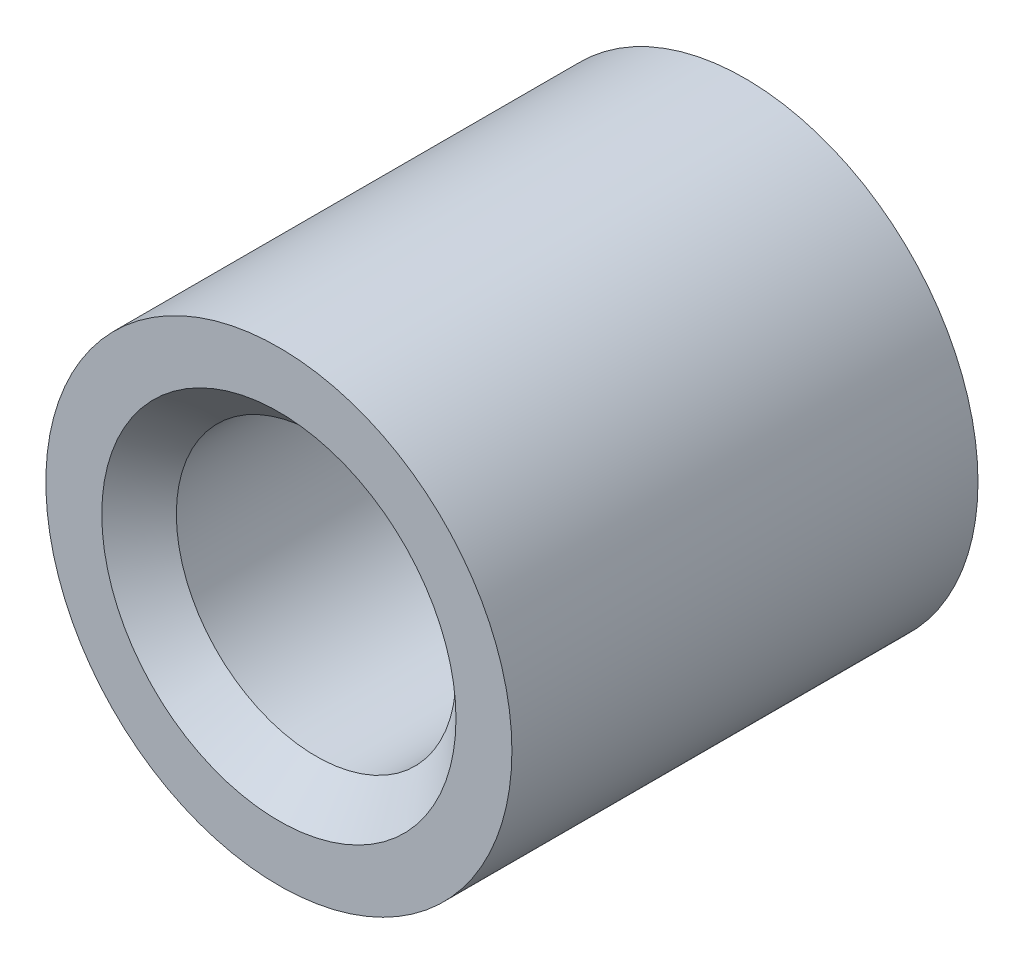
from build123d import *

# Parameters (mm, degrees)
SKETCH2_R           = 7.9375
SKETCH2_R_2         = 4.7625
BOSS_EXTRUDE1_DEPTH = 15.875
CHAMFER1_SIZE       = 1.27


with BuildPart() as part:
    # Sketch2 → Boss-Extrude1 (new body)
    with BuildSketch(Plane.XY):
        Circle(SKETCH2_R)
        Circle(SKETCH2_R_2, mode=Mode.SUBTRACT)
    extrude(amount=BOSS_EXTRUDE1_DEPTH)

    # Chamfer1
    chamfer1_edges = [part.edges().sort_by_distance(p)[0] for p in [
        (-4.7625, 0, 0),
        (-4.7625, 0, 15.875),
    ]]
    chamfer(chamfer1_edges, length=CHAMFER1_SIZE)


solid = part.part
